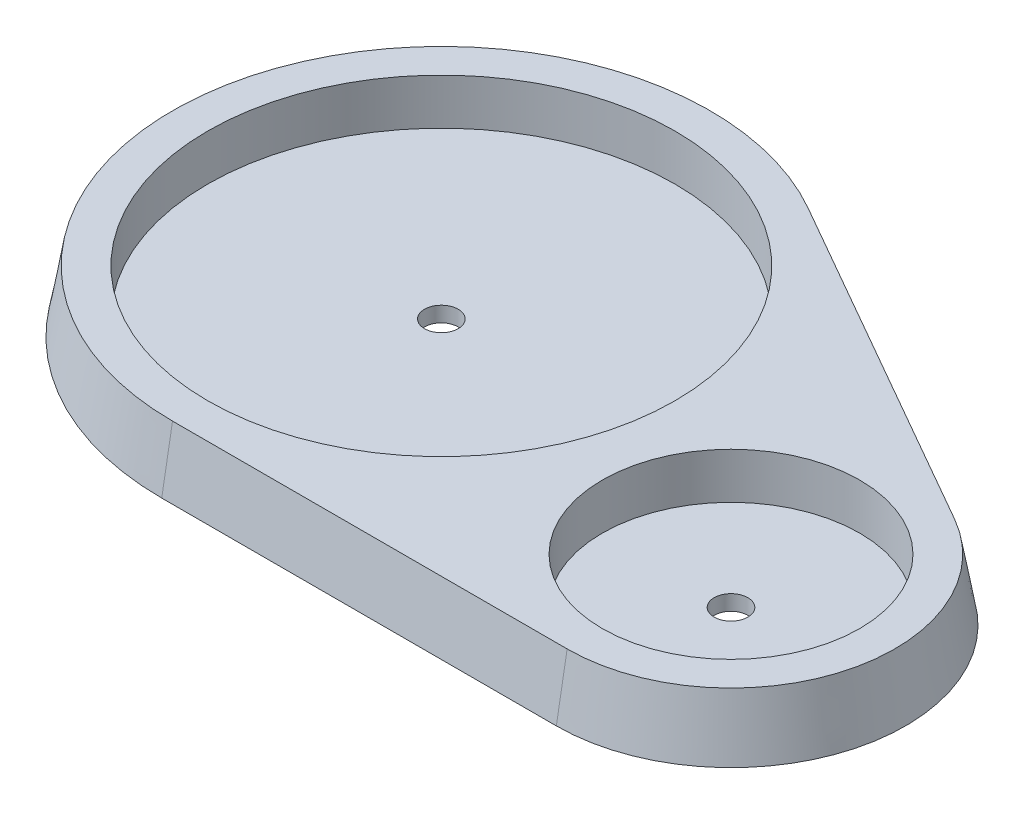
from build123d import *

# Parameters (mm, degrees)
BOSS_EXTRUDE1_DEPTH = 4
BOSS_EXTRUDE1_DRAFT = 10
CUT_EXTRUDE2_START  = 4
SKETCH1_5_R         = 1.1
CUT_EXTRUDE2_DEPTH  = 4
CUT_EXTRUDE3_START  = 4
SKETCH1_6_R         = 15.25
SKETCH1_6_R_2       = 1.1
SKETCH1_6_R_3       = 8.4
CUT_EXTRUDE3_DEPTH  = 3


with BuildPart() as part:
    # Sketch1 → Boss-Extrude1 (with draft: the straight prism first)
    with BuildSketch(Plane(origin=(0, 0, 0), x_dir=(1, 0, 0), z_dir=(0, 1, 0))):
        with BuildLine():
            ThreePointArc((9.066590645, 15.838542675), (-17.636835088, 4.690900563), (0, -18.25))
            Line((0, -18.25), (25.754611238, -18.25))
            ThreePointArc((25.754611238, -18.25), (36.771593155, -9.780206379), (31.418125394, 3.043665013))
            Line((31.418125394, 3.043665013), (9.066590645, 15.838542675))
        make_face()
    extrude(amount=BOSS_EXTRUDE1_DEPTH)
    # Boss-Extrude1: the draft: its side faces are tilted about the plane it starts from
    boss_extrude1_sides = [part.faces().sort_by_distance(p)[0] for p in [
        (-17.636835088, 2, -4.690900563),
        (12.877305619, 2, 18.25),
        (36.771593155, 2, 9.780206379),
        (20.24235802, 2, -9.441103844),
    ]]
    draft(boss_extrude1_sides, Plane(origin=(0, 0, 0), x_dir=(1, 0, 0), z_dir=(0, 1, 0)), BOSS_EXTRUDE1_DRAFT)

    # Sketch1<5> → Cut-Extrude2 (cut)
    with BuildSketch(Plane(origin=(0, 0, 0), x_dir=(1, 0, 0), z_dir=(0, 1, 0)).offset(CUT_EXTRUDE2_START)):
        with Locations(Location((0, 0, 0), (0, 0, 270))):
            Circle(SKETCH1_5_R)
        with Locations(Location((25.754611238, -6.85, 0), (0, 0, 270))):
            Circle(SKETCH1_5_R)
    extrude(amount=-CUT_EXTRUDE2_DEPTH, mode=Mode.SUBTRACT)

    # Sketch1<6> → Cut-Extrude3 (cut)
    # profile 1 of 2: a face of its own
    with BuildSketch(Plane(origin=(0, 0, 0), x_dir=(1, 0, 0), z_dir=(0, 1, 0)).offset(CUT_EXTRUDE3_START)):
        with Locations(Location((0, 0, 0), (0, 0, 270))):
            Circle(SKETCH1_6_R)
        with Locations(Location((0, 0, 0), (0, 0, 270))):
            Circle(SKETCH1_6_R_2, mode=Mode.SUBTRACT)
    # profile 2 of 2: a face of its own
    with BuildSketch(Plane(origin=(0, 0, 0), x_dir=(1, 0, 0), z_dir=(0, 1, 0)).offset(CUT_EXTRUDE3_START)):
        with Locations(Location((25.754611238, -6.85, 0), (0, 0, 270))):
            Circle(SKETCH1_6_R_3)
        with Locations(Location((25.754611238, -6.85, 0), (0, 0, 270))):
            Circle(SKETCH1_6_R_2, mode=Mode.SUBTRACT)
    extrude(amount=-CUT_EXTRUDE3_DEPTH, mode=Mode.SUBTRACT)


solid = part.part
